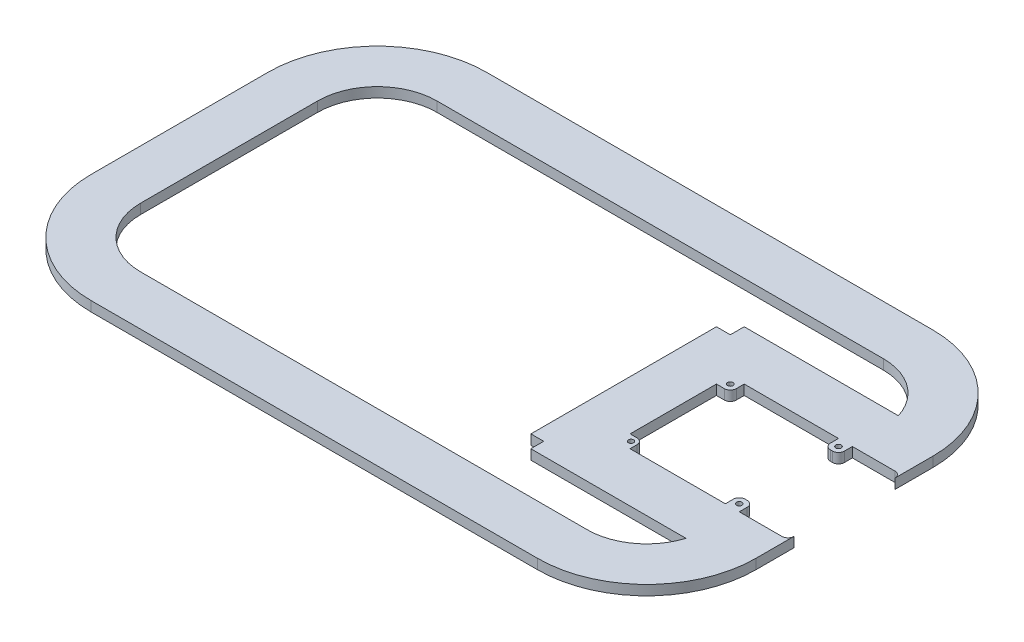
from build123d import *

# Parameters (mm, degrees)
SKETCH1_R           = 1.375
SKETCH1_R_2         = 1.318565094
BOSS_EXTRUDE1_DEPTH = 5


with BuildPart() as part:
    # Sketch1 → Boss-Extrude1 (new body)
    with BuildSketch(Plane(origin=(0, 0, 0), x_dir=(1, 0, 0), z_dir=(0, 1, 0))):
        with BuildLine():
            Line((279.931043908, -90.367567702), (279.931043908, -109.497567702))
            ThreePointArc((279.931043908, -109.497567702), (263.821916873, -148.388440667), (224.931043908, -164.497567702))
            Line((224.931043908, -164.497567702), (-0.098956092, -164.497567702))
            ThreePointArc((-0.098956092, -164.497567702), (-38.989829057, -148.388440667), (-55.098956092, -109.497567702))
            Line((-55.098956092, -109.497567702), (-55.098956092, -20.237567702))
            ThreePointArc((-55.098956092, -20.237567702), (-38.989829057, 18.653305263), (-0.098956092, 34.762432298))
            Line((-0.098956092, 34.762432298), (224.931043908, 34.762432298))
            ThreePointArc((224.931043908, 34.762432298), (263.821916873, 18.653305263), (279.931043908, -20.237567702))
            Line((279.931043908, -20.237567702), (279.931043908, -39.367567702))
            ThreePointArc((279.931043908, -39.367567702), (279.052364252, -37.246247359), (276.931043908, -36.367567702))
            Line((276.931043908, -36.367567702), (255.431043908, -36.367567702))
            Line((255.431043908, -36.367567702), (255.431043908, -40.367567702))
            ThreePointArc((255.431043908, -40.367567702), (254.552364252, -42.488888046), (252.431043908, -43.367567702))
            Line((252.431043908, -43.367567702), (251.431043908, -43.367567702))
            ThreePointArc((251.431043908, -43.367567702), (249.309723565, -42.488888046), (248.431043908, -40.367567702))
            Line((248.431043908, -40.367567702), (248.431043908, -36.367567702))
            Line((248.431043908, -36.367567702), (200.931043908, -36.367567702))
            Line((200.931043908, -36.367567702), (200.931043908, -40.367567702))
            ThreePointArc((200.931043908, -40.367567702), (200.052364252, -42.488888046), (197.931043908, -43.367567702))
            Line((197.931043908, -43.367567702), (193.931043908, -43.367567702))
            Line((193.931043908, -43.367567702), (193.931043908, -86.867567702))
            Line((193.931043908, -86.867567702), (197.397932751, -86.867567702))
            ThreePointArc((197.397932751, -86.867567702), (199.519253094, -87.746247359), (200.397932751, -89.867567702))
            Line((200.397932751, -89.867567702), (200.397932751, -93.367567702))
            Line((200.397932751, -93.367567702), (248.431043908, -93.367567702))
            Line((248.431043908, -93.367567702), (248.431043908, -89.367567702))
            ThreePointArc((248.431043908, -89.367567702), (249.309723565, -87.246247359), (251.431043908, -86.367567702))
            Line((251.431043908, -86.367567702), (252.431043908, -86.367567702))
            ThreePointArc((252.431043908, -86.367567702), (254.552364252, -87.246247359), (255.431043908, -89.367567702))
            Line((255.431043908, -89.367567702), (255.431043908, -93.367567702))
            Line((255.431043908, -93.367567702), (276.931043908, -93.367567702))
            ThreePointArc((276.931043908, -93.367567702), (279.052364252, -92.488888046), (279.931043908, -90.367567702))
        make_face()
        with Locations(Location((251.931043908, -39.867567702, 0), (0, 0, 270))):
            Circle(SKETCH1_R, mode=Mode.SUBTRACT)
        with Locations(Location((251.931043908, -89.867567702, 0), (0, 0, 270))):
            Circle(SKETCH1_R, mode=Mode.SUBTRACT)
        with Locations(Location((197.397932751, -89.867567702, 0), (0, 0, 270))):
            Circle(SKETCH1_R_2, mode=Mode.SUBTRACT)
        with Locations(Location((197.431043908, -39.867567702, 0), (0, 0, 270))):
            Circle(SKETCH1_R, mode=Mode.SUBTRACT)
        with BuildLine():
            Line((-0.098956092, -139.497567702), (224.931043908, -139.497567702))
            ThreePointArc((224.931043908, -139.497567702), (242.734133528, -133.643996009), (253.589779051, -118.367567702))
            Line((253.589779051, -118.367567702), (251.931043908, -118.367567702))
            Line((251.931043908, -118.367567702), (175.397932751, -118.367567702))
            Line((175.397932751, -118.367567702), (175.397932751, -111.867567702))
            Line((175.397932751, -111.867567702), (168.931043908, -111.867567702))
            Line((168.931043908, -111.867567702), (168.931043908, -18.367567702))
            Line((168.931043908, -18.367567702), (175.931043908, -18.367567702))
            Line((175.931043908, -18.367567702), (175.931043908, -11.367567702))
            Line((175.931043908, -11.367567702), (251.931043908, -11.367567702))
            Line((251.931043908, -11.367567702), (253.589779051, -11.367567702))
            ThreePointArc((253.589779051, -11.367567702), (242.734133528, 3.908860605), (224.931043908, 9.762432298))
            Line((224.931043908, 9.762432298), (-0.098956092, 9.762432298))
            ThreePointArc((-0.098956092, 9.762432298), (-21.312159527, 0.975635734), (-30.098956092, -20.237567702))
            Line((-30.098956092, -20.237567702), (-30.098956092, -109.497567702))
            ThreePointArc((-30.098956092, -109.497567702), (-21.312159527, -130.710771138), (-0.098956092, -139.497567702))
        make_face(mode=Mode.SUBTRACT)
    extrude(amount=BOSS_EXTRUDE1_DEPTH)


solid = part.part
